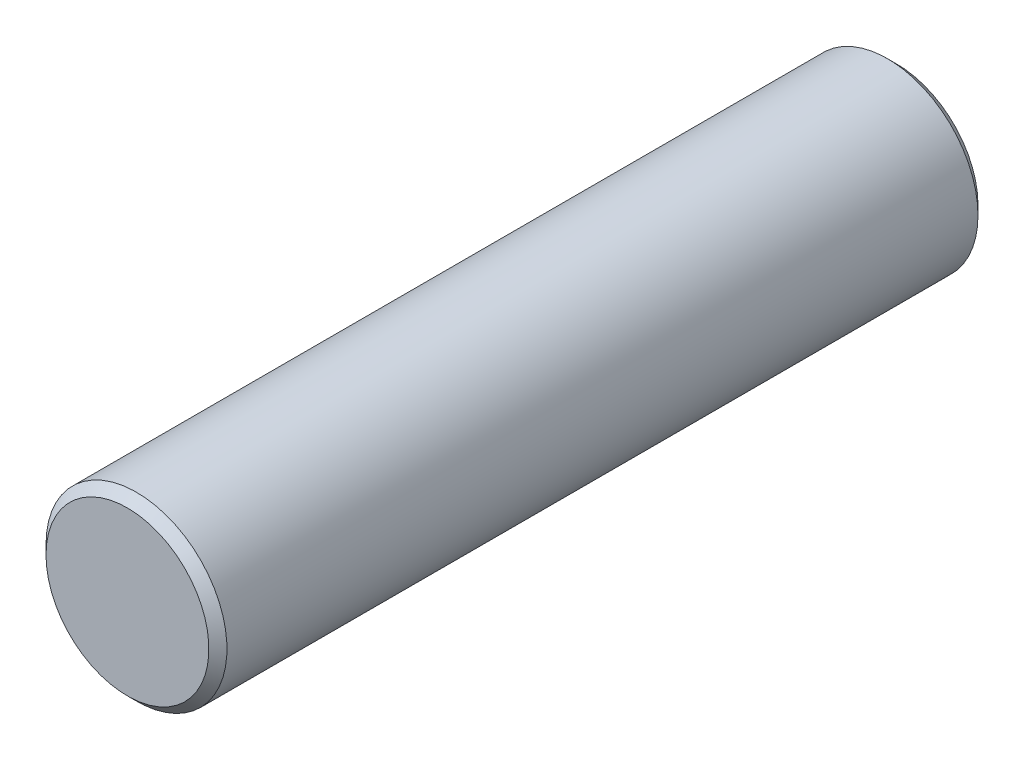
from build123d import *

# Parameters (mm, degrees)
SKETCH1_W          = 10
SKETCH1_H          = 85
CHAMFER1_SIZE      = 1
SKETCH2_R          = 0.5
CUT_EXTRUDE1_DEPTH = 3


with BuildPart() as part:
    # Sketch1 → Revolve1 (revolve)
    with BuildSketch(Plane(origin=(0, 0, 0), x_dir=(1, 0, 0), z_dir=(0, 1, 0))):
        with Locations((5, 42.5)):
            Rectangle(SKETCH1_W, SKETCH1_H)
    revolve(axis=Axis((0, 0, -85), (0, 0, 1)))

    # Chamfer1
    chamfer1_edges = [part.edges().sort_by_distance(p)[0] for p in [
        (-10, 0, -85),
        (-10, 0, 0),
    ]]
    chamfer(chamfer1_edges, length=CHAMFER1_SIZE)

    # Sketch2 → Cut-Extrude1 (cut)
    with BuildSketch(Plane(origin=(0, 0, -85), x_dir=(-1, 0, 0), z_dir=(0, 0, -1))):
        Circle(SKETCH2_R)
    extrude(amount=-CUT_EXTRUDE1_DEPTH, mode=Mode.SUBTRACT)


solid = part.part
